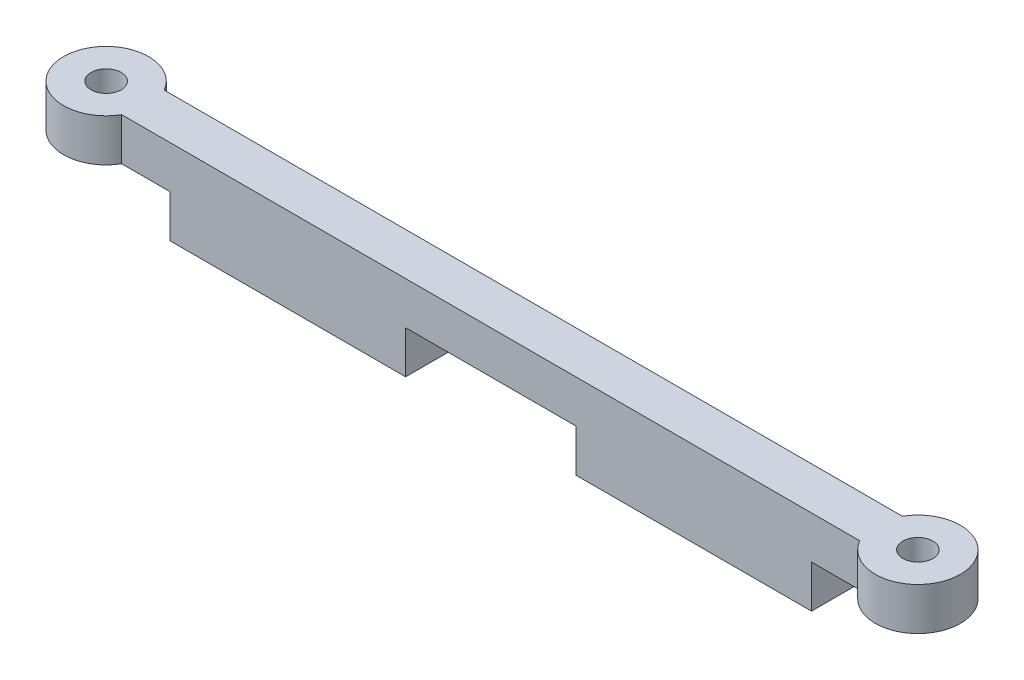
from build123d import *

# Parameters (mm, degrees)
BOSS_EXTRUDE1_DEPTH = 12.7
SKETCH2_R           = 2.2479
CUT_EXTRUDE1_DEPTH  = 6.35
SKETCH3_W           = 25.4
SKETCH3_H           = 6.35
CUT_EXTRUDE2_DEPTH  = 6.35


with BuildPart() as part:
    # Sketch1 → Boss-Extrude1 (new body)
    with BuildSketch(Plane(origin=(0, 0, 0), x_dir=(1, 0, 0), z_dir=(0, 1, 0))):
        with BuildLine():
            ThreePointArc((0, -2.2479), (-2.2479, 0), (0, 2.2479))
            Line((0, 2.2479), (0, 3.175))
            ThreePointArc((0, 3.175), (-3.175, 0), (0, -3.175))
            Line((0, -3.175), (0, -2.2479))
        make_face()
        with BuildLine():
            ThreePointArc((0, -3.175), (-3.175, 0), (0, 3.175))
            Line((0, 3.175), (5.499261314, 3.175))
            ThreePointArc((5.499261314, 3.175), (-6.35, 0), (5.499261314, -3.175))
            Line((5.499261314, -3.175), (0, -3.175))
        make_face()
        with BuildLine():
            ThreePointArc((0, 2.2479), (1.589505333, 1.589505333), (2.2479, 0))
            Line((2.2479, 0), (3.175, 0))
            ThreePointArc((3.175, 0), (2.24506403, 2.24506403), (0, 3.175))
            Line((0, 3.175), (0, 2.2479))
        make_face()
        with BuildLine():
            Line((3.175, 0), (2.2479, 0))
            ThreePointArc((2.2479, 0), (1.589505333, -1.589505333), (0, -2.2479))
            Line((0, -2.2479), (0, -3.175))
            ThreePointArc((0, -3.175), (2.24506403, -2.24506403), (3.175, 0))
        make_face()
        with BuildLine():
            ThreePointArc((0, 3.175), (2.24506403, 2.24506403), (3.175, 0))
            Line((3.175, 0), (6.35, 0))
            ThreePointArc((6.35, 0), (6.133628997, 1.643500936), (5.499261314, 3.175))
            Line((5.499261314, 3.175), (0, 3.175))
        make_face()
        with BuildLine():
            Line((6.35, 0), (3.175, 0))
            ThreePointArc((3.175, 0), (2.24506403, -2.24506403), (0, -3.175))
            Line((0, -3.175), (5.499261314, -3.175))
            ThreePointArc((5.499261314, -3.175), (6.133628997, -1.643500936), (6.35, 0))
        make_face()
        with BuildLine():
            ThreePointArc((5.499261314, 3.175), (6.133628997, 1.643500936), (6.35, 0))
            Line((6.35, 0), (114.808, 0))
            ThreePointArc((114.808, 0), (115.024371003, 1.643500936), (115.658738686, 3.175))
            Line((115.658738686, 3.175), (5.499261314, 3.175))
        make_face()
        with BuildLine():
            Line((114.808, 0), (6.35, 0))
            ThreePointArc((6.35, 0), (6.133628997, -1.643500936), (5.499261314, -3.175))
            Line((5.499261314, -3.175), (115.658738686, -3.175))
            ThreePointArc((115.658738686, -3.175), (115.024371003, -1.643500936), (114.808, 0))
        make_face()
        with BuildLine():
            ThreePointArc((115.658738686, 3.175), (115.024371003, 1.643500936), (114.808, 0))
            Line((114.808, 0), (117.983, 0))
            ThreePointArc((117.983, 0), (118.91293597, 2.24506403), (121.158, 3.175))
            Line((121.158, 3.175), (115.658738686, 3.175))
        make_face()
        with BuildLine():
            Line((117.983, 0), (114.808, 0))
            ThreePointArc((114.808, 0), (115.024371003, -1.643500936), (115.658738686, -3.175))
            Line((115.658738686, -3.175), (121.158, -3.175))
            ThreePointArc((121.158, -3.175), (118.91293597, -2.24506403), (117.983, 0))
        make_face()
        with BuildLine():
            ThreePointArc((121.158, 3.175), (118.91293597, 2.24506403), (117.983, 0))
            Line((117.983, 0), (118.9101, 0))
            ThreePointArc((118.9101, 0), (119.568494667, 1.589505333), (121.158, 2.2479))
            Line((121.158, 2.2479), (121.158, 3.175))
        make_face()
        with BuildLine():
            Line((118.9101, 0), (117.983, 0))
            ThreePointArc((117.983, 0), (118.91293597, -2.24506403), (121.158, -3.175))
            ThreePointArc((121.158, -3.175), (123.40306403, -2.24506403), (124.333, 0))
            ThreePointArc((124.333, 0), (123.40306403, 2.24506403), (121.158, 3.175))
            Line((121.158, 3.175), (121.158, 2.2479))
            ThreePointArc((121.158, 2.2479), (122.747505333, 1.589505333), (123.4059, 0))
            ThreePointArc((123.4059, 0), (121.158, -2.2479), (118.9101, 0))
        make_face()
        with BuildLine():
            ThreePointArc((127.508, 0), (122.801500936, 6.133628997), (115.658738686, 3.175))
            Line((115.658738686, 3.175), (121.158, 3.175))
            ThreePointArc((121.158, 3.175), (123.40306403, 2.24506403), (124.333, 0))
            ThreePointArc((124.333, 0), (123.40306403, -2.24506403), (121.158, -3.175))
            Line((121.158, -3.175), (115.658738686, -3.175))
            ThreePointArc((115.658738686, -3.175), (122.801500936, -6.133628997), (127.508, 0))
        make_face()
    extrude(amount=BOSS_EXTRUDE1_DEPTH)

    # Sketch2 → Cut-Extrude1 (cut)
    # profile 1 of 6: a face of its own
    with BuildSketch(Plane.XZ):
        with BuildLine():
            Line((12.7, -3.175), (12.7, 3.175))
            Line((12.7, 3.175), (5.499261314, 3.175))
            ThreePointArc((5.499261314, 3.175), (6.133628997, 1.643500936), (6.35, 0))
            ThreePointArc((6.35, 0), (6.133628997, -1.643500936), (5.499261314, -3.175))
            Line((5.499261314, -3.175), (12.7, -3.175))
        make_face()
    # profile 2 of 6: a face of its own
    with BuildSketch(Plane.XZ):
        with BuildLine():
            ThreePointArc((6.35, 0), (6.133628997, 1.643500936), (5.499261314, 3.175))
            Line((5.499261314, 3.175), (2.654111014, 3.175))
            Line((2.654111014, 3.175), (2.654111014, -3.175))
            Line((2.654111014, -3.175), (5.499261314, -3.175))
            ThreePointArc((5.499261314, -3.175), (6.133628997, -1.643500936), (6.35, 0))
        make_face()
    # profile 3 of 6: a face of its own
    with BuildSketch(Plane.XZ):
        with BuildLine():
            Line((2.654111014, 3.175), (5.499261314, 3.175))
            ThreePointArc((5.499261314, 3.175), (-6.35, 0), (5.499261314, -3.175))
            Line((5.499261314, -3.175), (2.654111014, -3.175))
            Line((2.654111014, -3.175), (2.654111014, 3.175))
        make_face()
        with Locations(Location((0, 0, 0), (0, 0, 270))):
            Circle(SKETCH2_R, mode=Mode.SUBTRACT)
    # profile 4 of 6: a face of its own
    with BuildSketch(Plane.XZ):
        with BuildLine():
            ThreePointArc((127.508, 0), (122.801500936, 6.133628997), (115.658738686, 3.175))
            Line((115.658738686, 3.175), (118.641772853, 3.175))
            Line((118.641772853, 3.175), (118.641772853, -3.175))
            Line((118.641772853, -3.175), (115.658738686, -3.175))
            ThreePointArc((115.658738686, -3.175), (122.801500936, -6.133628997), (127.508, 0))
        make_face()
        with Locations(Location((121.158, 0, 0), (0, 0, 270))):
            Circle(SKETCH2_R, mode=Mode.SUBTRACT)
    # profile 5 of 6: a face of its own
    with BuildSketch(Plane.XZ):
        with BuildLine():
            Line((115.658738686, 3.175), (108.458, 3.175))
            Line((108.458, 3.175), (108.458, -3.175))
            Line((108.458, -3.175), (115.658738686, -3.175))
            ThreePointArc((115.658738686, -3.175), (114.808, 0), (115.658738686, 3.175))
        make_face()
    # profile 6 of 6: a face of its own
    with BuildSketch(Plane.XZ):
        with BuildLine():
            Line((118.641772853, 3.175), (115.658738686, 3.175))
            ThreePointArc((115.658738686, 3.175), (114.808, 0), (115.658738686, -3.175))
            Line((115.658738686, -3.175), (118.641772853, -3.175))
            Line((118.641772853, -3.175), (118.641772853, 3.175))
        make_face()
    extrude(amount=-CUT_EXTRUDE1_DEPTH, mode=Mode.SUBTRACT)

    # Sketch3 → Cut-Extrude2 (cut)
    with BuildSketch(Plane.XZ):
        with Locations((60.579, 0)):
            Rectangle(SKETCH3_W, SKETCH3_H)
    extrude(amount=-CUT_EXTRUDE2_DEPTH, mode=Mode.SUBTRACT)


solid = part.part
